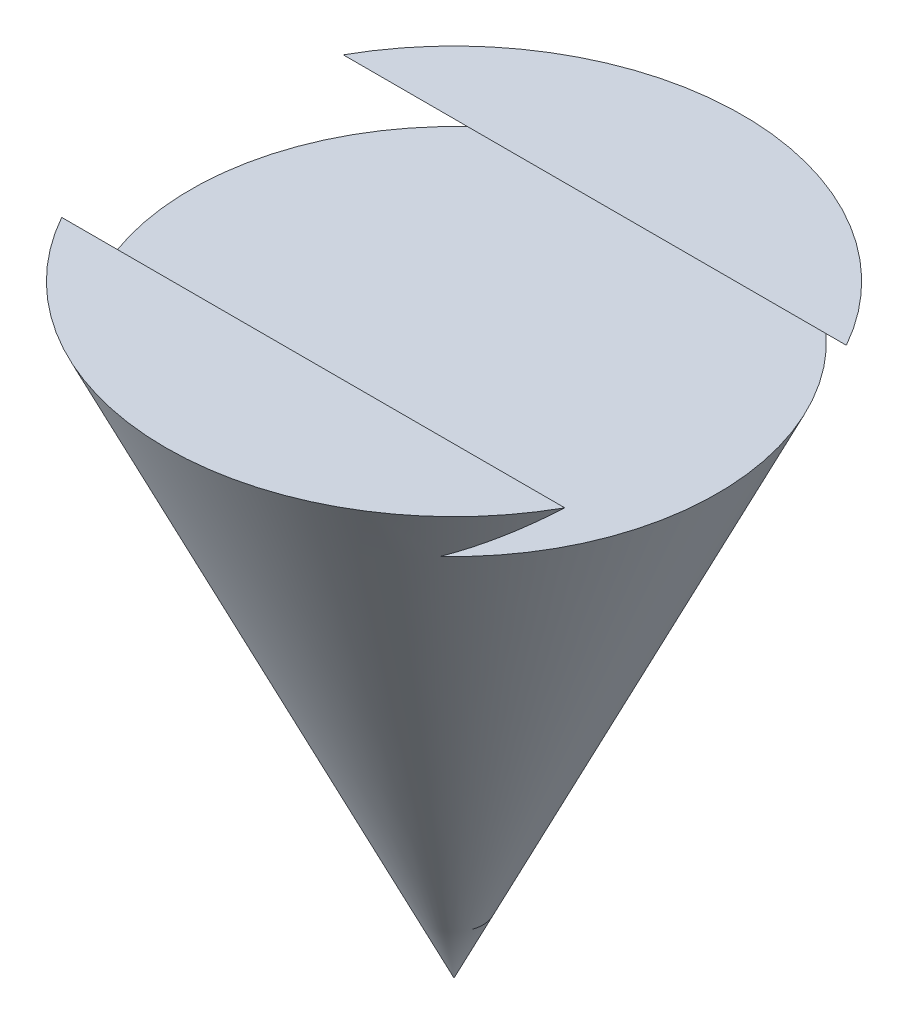
from build123d import *

# Parameters (mm, degrees)
CUT_EXTRUDE1_DEPTH      = 55.309299388
CUT_EXTRUDE1_DEPTH_BACK = 55.309299388


with BuildPart() as part:
    # Sketch1 → Revolve1 (revolve)
    with BuildSketch(Plane(origin=(0, 0, 0), x_dir=(0, 0, -1), z_dir=(1, 0, 0)), mode=Mode.PRIVATE) as revolve1_sk:
        Polygon((0, 0), (0, -45), (21.5, 0), align=None)
    revolve(revolve1_sk.sketch.rotate(Axis((0, 0, 0), (0, -1, 0)), 180), axis=Axis((0, 0, 0), (0, -1, 0)))

    # Sketch2 → Cut-Extrude1 (cut, two sides: drawn at the far end of the back side and taken through both)
    with BuildSketch(Plane(origin=(0, 0, 0), x_dir=(0, 0, -1), z_dir=(1, 0, 0)).offset(-CUT_EXTRUDE1_DEPTH_BACK)):
        Polygon((0, 0), (10.5, 0), (14.389087297, -3.889087297), (-14.389087297, -3.889087297), (-10.5, 0), align=None)
    extrude(amount=CUT_EXTRUDE1_DEPTH + CUT_EXTRUDE1_DEPTH_BACK, mode=Mode.SUBTRACT)


solid = part.part
